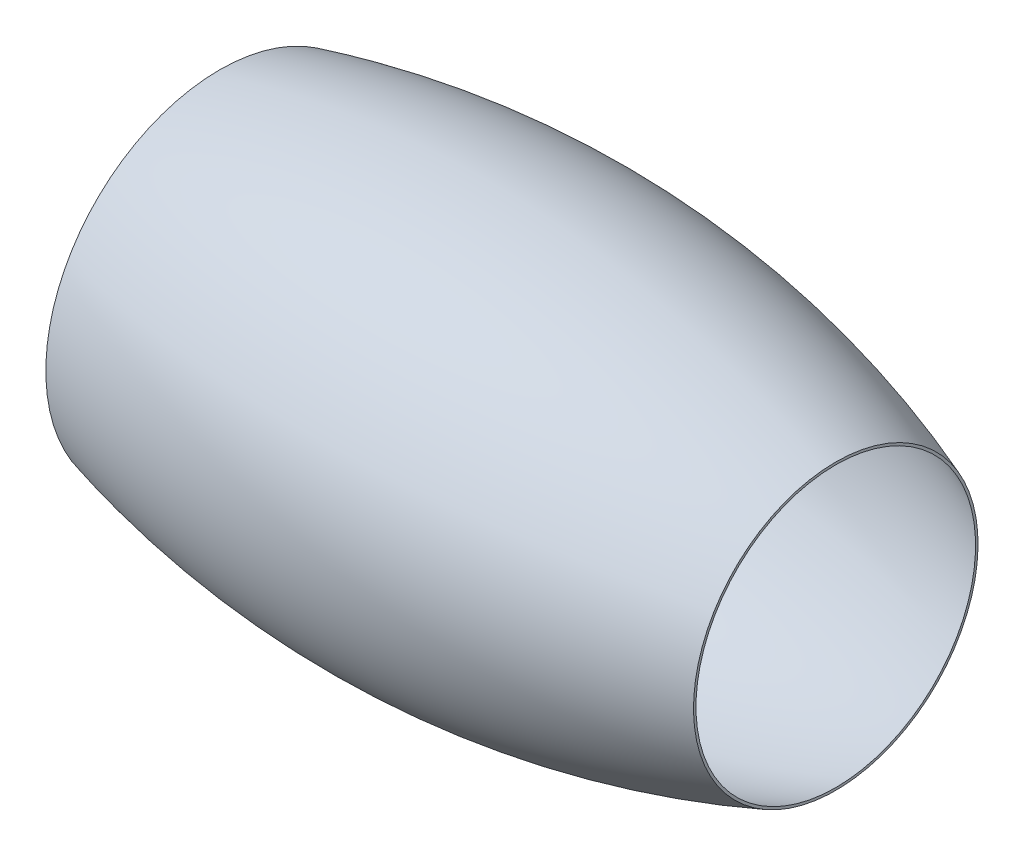
from build123d import *


with BuildPart() as part:
    # Sketch1 → Revolve1 (revolve)
    with BuildSketch(Plane.XY):
        with BuildLine():
            Line((-2.536666517, 281.508969578), (-1.772396497, 278.607954009))
            ThreePointArc((-1.772396497, 278.607954009), (500.406733445, 330.111173868), (994.577297147, 227))
            Line((994.577297147, 227), (994.577297147, 231))
            ThreePointArc((994.577297147, 231), (498.357652016, 334.348867524), (-5.819817097, 282.195207343))
            Line((-5.819817097, 282.195207343), (-5.437682087, 280.744699559))
            Line((-5.437682087, 280.744699559), (-2.536666517, 281.508969578))
        make_face()
    revolve(axis=Axis((1000, 0, 0), (-1, 0, 0)))


solid = part.part
